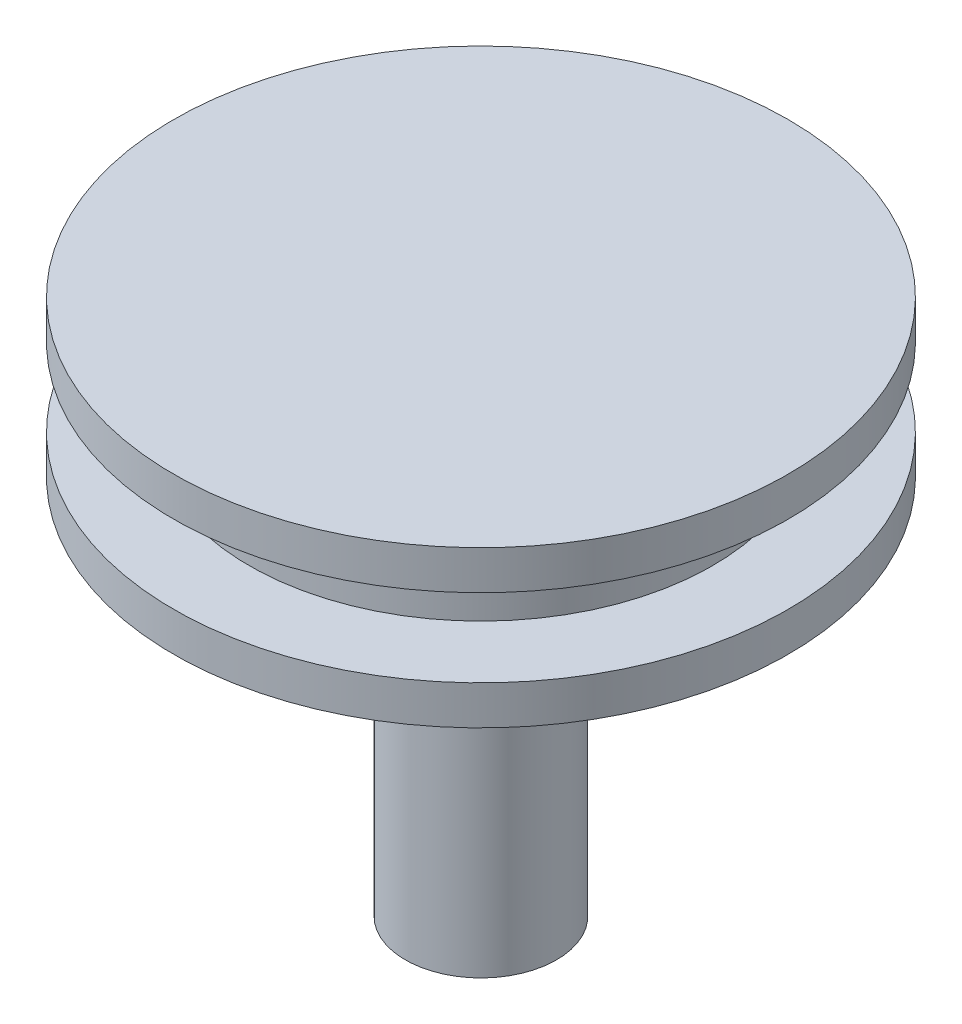
from build123d import *


with BuildPart() as part:
    # Sketch1 → Revolve1 (revolve)
    with BuildSketch(Plane(origin=(0, 0, 0), x_dir=(0, 0, -1), z_dir=(1, 0, 0))):
        Polygon((0, 0), (0, 11), (6.3, 11), (6.3, 10.2), (4.75, 10.2), (4.75, 8.6), (6.3, 8.6), (6.3, 7.8), (1.55, 7.8), (1.55, 0), align=None)
    revolve(axis=Axis((0, 0, 0), (0, 1, 0)))


solid = part.part
